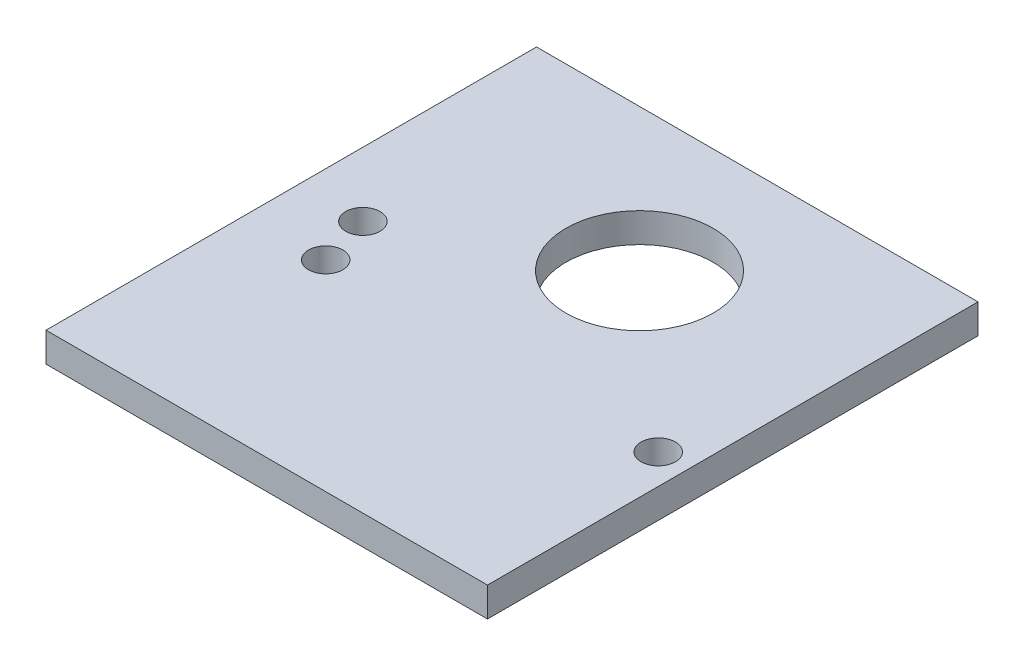
from build123d import *

# Parameters (mm, degrees)
SKETCH2_W           = 45
SKETCH2_H           = 50
SKETCH2_R           = 7.5
BOSS_EXTRUDE1_DEPTH = 3
SKETCH1_R           = 1.75
CUT_EXTRUDE1_DEPTH  = 3


with BuildPart() as part:
    # Sketch2 → Boss-Extrude1 (new body)
    with BuildSketch(Plane(origin=(0, 0, 0), x_dir=(1, 0, 0), z_dir=(0, 1, 0))):
        with Locations((-2.5, -2.5)):
            Rectangle(SKETCH2_W, SKETCH2_H)
        with Locations(Location((0, 8, 0), (0, 0, 270))):
            Circle(SKETCH2_R, mode=Mode.SUBTRACT)
    extrude(amount=-BOSS_EXTRUDE1_DEPTH)

    # Sketch1 → Cut-Extrude1 (cut)
    with BuildSketch(Plane(origin=(0, 0, 0), x_dir=(1, 0, 0), z_dir=(0, 1, 0))):
        with Locations(Location((-18.45, -1.75, 0), (0, 0, 270))):
            Circle(SKETCH1_R)
        with Locations(Location((16.95, -7.041502622, 0), (0, 0, 270))):
            Circle(SKETCH1_R)
        with Locations(Location((-16.95, -7.041502622, 0), (0, 0, 270))):
            Circle(SKETCH1_R)
    extrude(amount=-CUT_EXTRUDE1_DEPTH, mode=Mode.SUBTRACT)


solid = part.part
